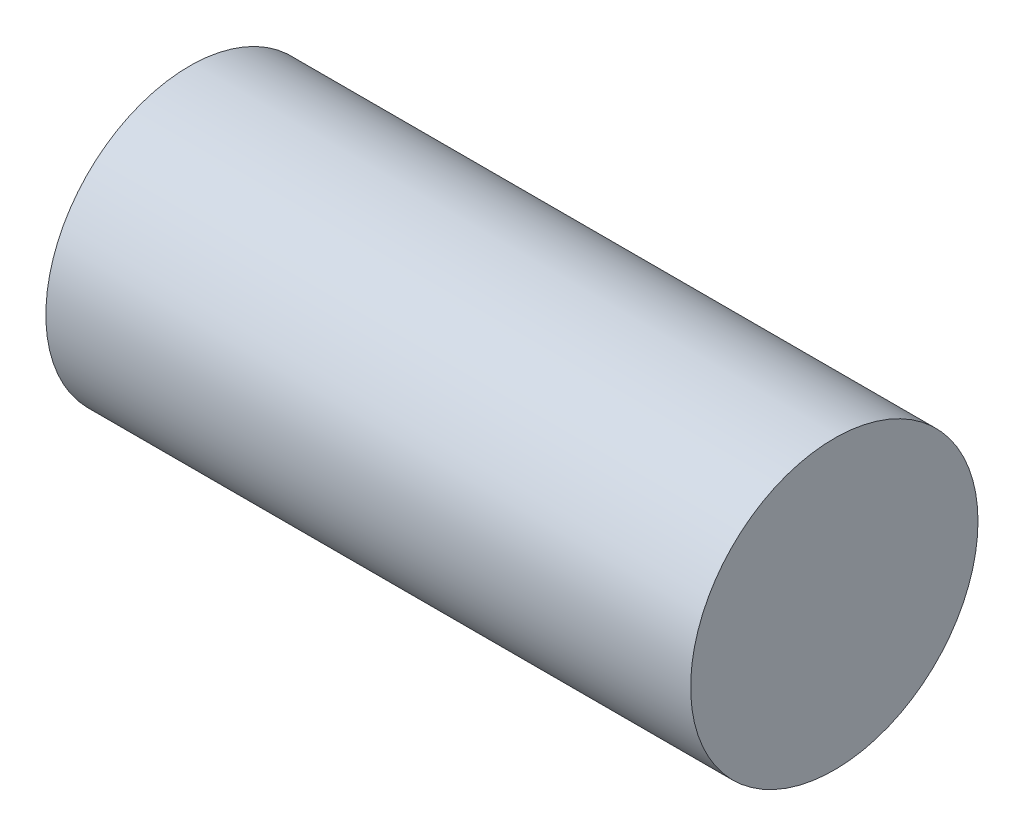
from build123d import *

# Parameters (mm, degrees)
SKETCH1_R           = 6.35
BOSS_EXTRUDE1_DEPTH = 28.4988


with BuildPart() as part:
    # Sketch1 → Boss-Extrude1 (new body)
    with BuildSketch(Plane(origin=(0, 0, 0), x_dir=(0, 0, -1), z_dir=(1, 0, 0))):
        Circle(SKETCH1_R)
    extrude(amount=BOSS_EXTRUDE1_DEPTH)


solid = part.part
